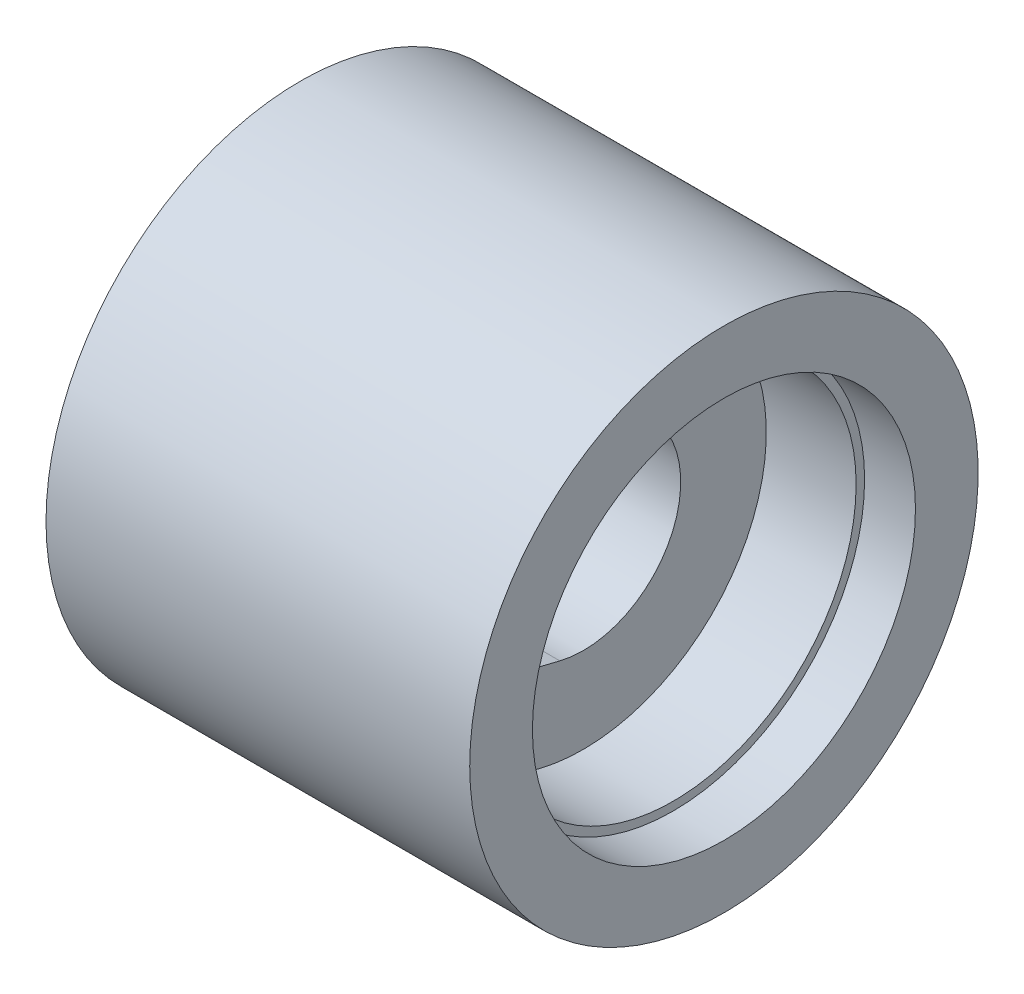
from build123d import *

# Parameters (mm, degrees)
EXTRUDE1_DEPTH = 167
EXTRUDE2_DEPTH = 125
EXTRUDE3_DEPTH = 77
SKETCH10_R     = 15
EXTRUDE4_DEPTH = 1


with BuildPart() as part:
    # Sketch1 → Revolve1 (revolve)
    with BuildSketch(Plane.XY, mode=Mode.PRIVATE) as revolve1_sk:
        Polygon((0, 113), (-30, 113), (-30, 108), (-83, 108), (-83, 57.5), (-250, 57.5), (-250, 150), (0, 150), align=None)
    revolve(revolve1_sk.sketch.rotate(Axis((0, 0, 0), (1, 0, 0)), 90), axis=Axis((0, 0, 0), (1, 0, 0)))

    # Sketch2 → Extrude1 (cut)
    with BuildSketch(Plane.ZY.offset(250)):
        with BuildLine():
            Line((13.8, -55.819441058), (108.04, -32.520891747))
            ThreePointArc((108.04, -32.520891747), (133.5, 0), (108.04, 32.520891747))
            Line((108.04, 32.520891747), (13.8, 55.819441058))
            ThreePointArc((13.8, 55.819441058), (57.5, 0), (13.8, -55.819441058))
        make_face()
    extrude(amount=-EXTRUDE1_DEPTH, mode=Mode.SUBTRACT)

    # Sketch5 → Cut-Revolve1 (revolve, cut)
    with BuildSketch(Plane.XY, mode=Mode.PRIVATE) as cut_revolve1_sk:
        Polygon((-125, 135.5), (-262.537169633, 135.5), (-262.537169633, 100), (-106, 100), (-106, 125), (-108, 125), (-108, 127.5), (-121, 127.5), (-121, 128.5), (-122, 128.5), (-122, 127.5), (-125, 127.5), align=None)
    revolve(cut_revolve1_sk.sketch.rotate(Axis((-262.537169633, 100, 0), (1, 0, 0)), 90), axis=Axis((-262.537169633, 100, 0), (1, 0, 0)), mode=Mode.SUBTRACT)

    # Sketch6 → Extrude2 (cut)
    with BuildSketch(Plane.ZY.offset(250)):
        with BuildLine():
            Line((-34.630245451, 107.81), (-56.091242632, 12.65))
            ThreePointArc((-56.091242632, 12.65), (0, -57.5), (56.091242632, 12.65))
            Line((56.091242632, 12.65), (34.630245451, 107.81))
            ThreePointArc((34.630245451, 107.81), (0, 135.5), (-34.630245451, 107.81))
        make_face()
    extrude(amount=-EXTRUDE2_DEPTH, mode=Mode.SUBTRACT)

    # Sketch7 → Cut-Revolve2 (revolve, cut)
    with BuildSketch(Plane(origin=(0, 0, 0), x_dir=(1, 0, 0), z_dir=(0, 1, 0))):
        Polygon((-250, 135.5), (-173, 135.5), (-173, 127.5), (-170, 127.5), (-170, 128.5), (-169, 128.5), (-169, 127.5), (-156, 127.5), (-156, 125), (-154, 125), (-154, 100), (-250, 100), align=None)
    revolve(axis=Axis((-154, 0, -100), (-1, 0, 0)), mode=Mode.SUBTRACT)

    # Sketch8 → Extrude3 (cut)
    with BuildSketch(Plane.ZY.offset(250)):
        with BuildLine():
            Line((-107.81, 34.630245451), (-12.65, 56.091242632))
            ThreePointArc((-12.65, 56.091242632), (57.5, 0), (-12.65, -56.091242632))
            Line((-12.65, -56.091242632), (-107.81, -34.630245451))
            ThreePointArc((-107.81, -34.630245451), (-135.5, 0), (-107.81, 34.630245451))
        make_face()
    extrude(amount=-EXTRUDE3_DEPTH, mode=Mode.SUBTRACT)

    # Sketch10 → Extrude4 (cut)
    with BuildSketch(Plane(origin=(0, -150, 0), x_dir=(-1, 0, 0), z_dir=(0, -1, 0))):
        with Locations(Location((125, 0, 0), (0, 0, 90))):
            Circle(SKETCH10_R)
    extrude(amount=-EXTRUDE4_DEPTH, mode=Mode.SUBTRACT)


solid = part.part
